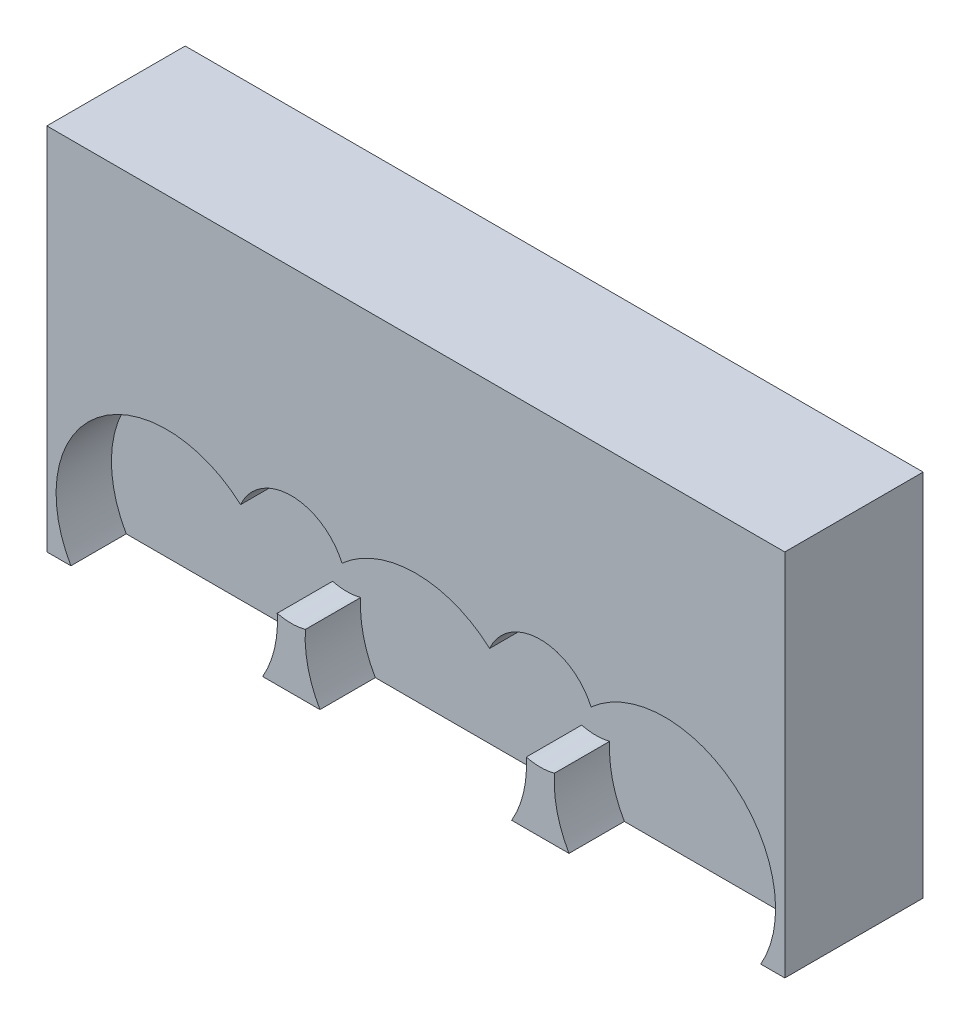
from build123d import *

# Parameters (mm, degrees)
SKETCH1_W           = 80
SKETCH1_H           = 40
BOSS_EXTRUDE1_DEPTH = 15
SKETCH2_R           = 12
SKETCH2_R_2         = 6
CUT_EXTRUDE1_DEPTH  = 6


with BuildPart() as part:
    # Sketch1 → Boss-Extrude1 (new body)
    with BuildSketch(Plane.XY):
        Rectangle(SKETCH1_W, SKETCH1_H)
    extrude(amount=BOSS_EXTRUDE1_DEPTH)

    # Sketch2 → Cut-Extrude1 (cut)
    with BuildSketch(Plane.XY.offset(15)):
        with Locations((0, -14)):
            Circle(SKETCH2_R)
        with Locations((-13.5, -7.461651585)):
            Circle(SKETCH2_R_2)
        with Locations((-27, -14)):
            Circle(SKETCH2_R)
        with BuildLine():
            Line((-37.392304845, -20), (-16.607695155, -20))
            ThreePointArc((-16.607695155, -20), (-15.408890085, -17.105828541), (-15, -14))
            ThreePointArc((-15, -14), (-15.005629858, -13.632461014), (-15.022514151, -13.265266894))
            ThreePointArc((-15.022514151, -13.265266894), (-18.9, -10.076990951), (-18.997485849, -5.057977451))
            ThreePointArc((-18.997485849, -5.057977451), (-34.565962223, -4.685698327), (-37.392304845, -20))
        make_face()
        with BuildLine():
            ThreePointArc((10.392304845, -20), (11.591109915, -17.105828541), (12, -14))
            ThreePointArc((12, -14), (11.994370142, -13.632461014), (11.977485849, -13.265266894))
            ThreePointArc((11.977485849, -13.265266894), (8.1, -10.076990951), (8.002514151, -5.057977451))
            ThreePointArc((8.002514151, -5.057977451), (0, -2), (-8.002514151, -5.057977451))
            ThreePointArc((-8.002514151, -5.057977451), (-7.626972029, -6.233831381), (-7.5, -7.461651585))
            ThreePointArc((-7.5, -7.461651585), (-8.749469245, -11.12668331), (-11.977485849, -13.265266894))
            ThreePointArc((-11.977485849, -13.265266894), (-11.680797979, -16.749356028), (-10.392304845, -20))
            Line((-10.392304845, -20), (10.392304845, -20))
        make_face()
        with BuildLine():
            ThreePointArc((19.5, -7.461651585), (18.250530755, -11.12668331), (15.022514151, -13.265266894))
            ThreePointArc((15.022514151, -13.265266894), (15.319202021, -16.749356028), (16.607695155, -20))
            Line((16.607695155, -20), (37.392304845, -20))
            ThreePointArc((37.392304845, -20), (38.591109915, -17.105828541), (39, -14))
            ThreePointArc((39, -14), (31.897439647, -3.044860343), (18.997485849, -5.057977451))
            ThreePointArc((18.997485849, -5.057977451), (19.373027971, -6.233831381), (19.5, -7.461651585))
        make_face()
        with Locations((13.5, -7.461651585)):
            Circle(SKETCH2_R_2)
        with Locations((27, -14)):
            Circle(SKETCH2_R)
    extrude(amount=-CUT_EXTRUDE1_DEPTH, mode=Mode.SUBTRACT)


solid = part.part
